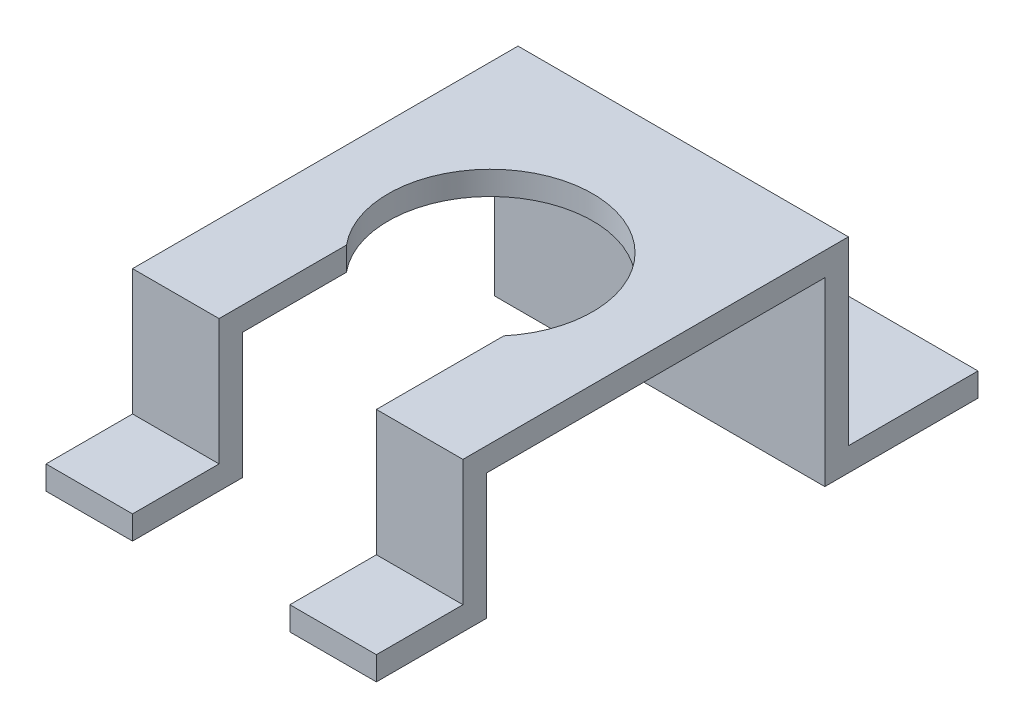
from build123d import *

# Parameters (mm, degrees)
BOSS_EXTRUDE1_DEPTH = 42
CUT_EXTRUDE1_DEPTH  = 107.244079886


with BuildPart() as part:
    # Sketch2 → Boss-Extrude1 (new body)
    with BuildSketch(Plane(origin=(0, 0, 0), x_dir=(0, 0, -1), z_dir=(1, 0, 0))):
        Polygon((74.588748486, 0), (94.062768994, 0), (94.062768994, 3), (77.588748486, 3), (77.588748486, 26), (28.588748486, 26), (28.588748486, 10), (17.588748486, 10), (17.588748486, 7), (31.588748486, 7), (31.588748486, 23), (74.588748486, 23), align=None)
    extrude(amount=BOSS_EXTRUDE1_DEPTH)

    # Sketch3 → Cut-Extrude1 (cut, through all)
    with BuildSketch(Plane(origin=(0, 26, 0), x_dir=(1, 0, 0), z_dir=(0, 1, 0))):
        with BuildLine():
            Line((11, 17.588748486), (11, 44.782124623))
            ThreePointArc((11, 44.782124623), (21, 66.088748486), (31, 44.782124623))
            Line((31, 44.782124623), (31, 17.588748486))
            Line((31, 17.588748486), (11, 17.588748486))
        make_face()
    extrude(amount=-CUT_EXTRUDE1_DEPTH, mode=Mode.SUBTRACT)


solid = part.part
